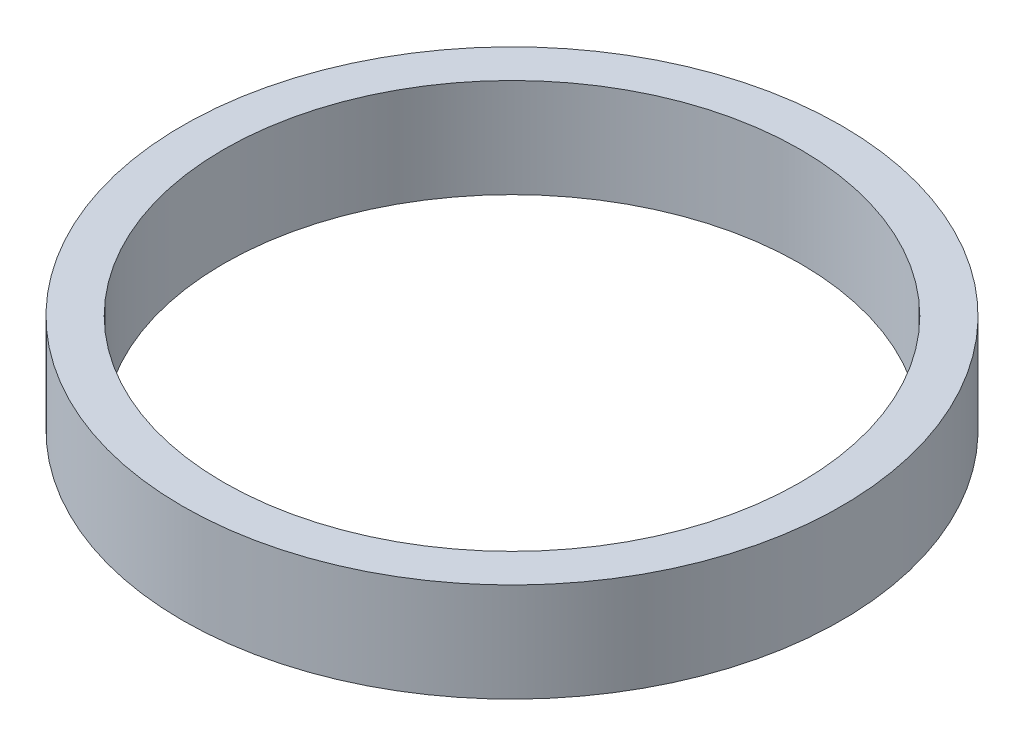
from build123d import *

# Parameters (mm, degrees)
SKETCH_1_R      = 10
SKETCH_1_R_2    = 8.75
EXTRUDE_1_DEPTH = 3


with BuildPart() as part:
    # Эскиз1 → Бобышка-Вытянуть1 (new body)
    with BuildSketch(Plane(origin=(0, 0, 0), x_dir=(1, 0, 0), z_dir=(0, 1, 0))):
        with Locations(Location((0, 0, 0), (0, 0, 270))):
            Circle(SKETCH_1_R)
        with Locations(Location((0, 0, 0), (0, 0, 270))):
            Circle(SKETCH_1_R_2, mode=Mode.SUBTRACT)
    extrude(amount=EXTRUDE_1_DEPTH)


solid = part.part
